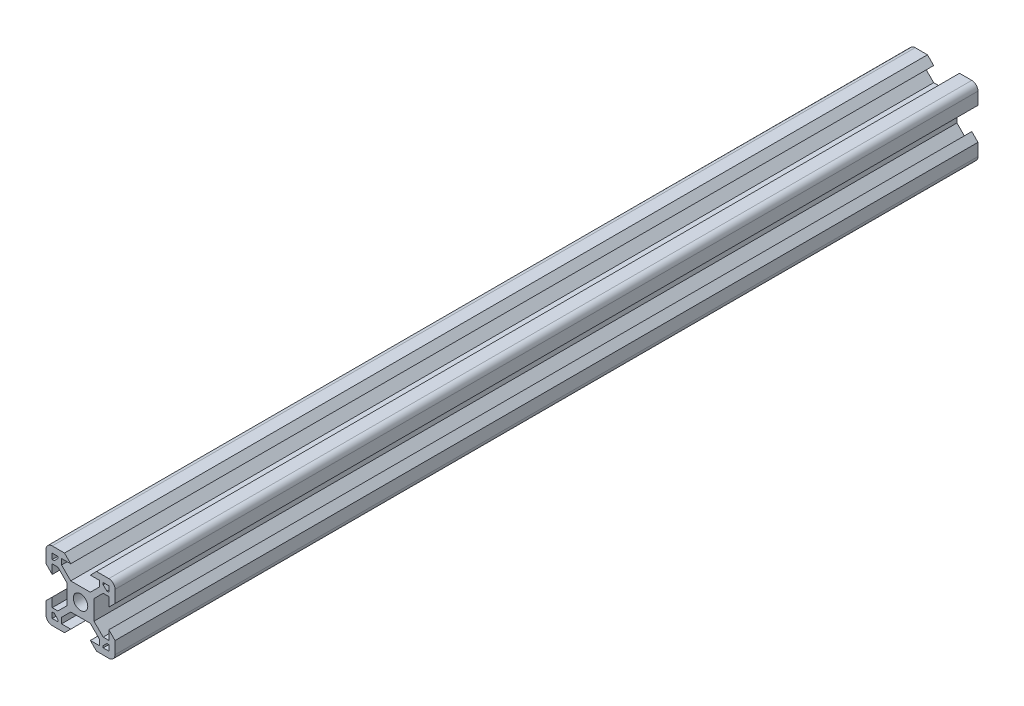
from build123d import *

# Parameters (mm, degrees)
ESQUISSE1_R        = 2.1
BOSS_EXTRU_2_DEPTH = 125


with BuildPart() as part:
    # Esquisse1 → Boss.-Extru.2 (new, symmetric)
    with BuildSketch(Plane.XY):
        with BuildLine():
            Line((-3.900660172, 0), (-3.900660172, -2.84))
            Line((-3.900660172, -2.84), (-6.56, -5.499339828))
            Line((-6.56, -5.499339828), (-8.2, -5.499339828))
            Line((-8.2, -5.499339828), (-8.2, -2.84))
            Line((-8.2, -2.84), (-10, -4.64))
            Line((-10, -4.64), (-10, -8.2))
            ThreePointArc((-10, -8.2), (-9.472792206, -9.472792206), (-8.2, -10))
            Line((-8.2, -10), (-4.64, -10))
            Line((-4.64, -10), (-2.84, -8.2))
            Line((-2.84, -8.2), (-5.499339828, -8.2))
            Line((-5.499339828, -8.2), (-5.499339828, -6.56))
            Line((-5.499339828, -6.56), (-2.84, -3.900660172))
            Line((-2.84, -3.900660172), (0, -3.900660172))
            Line((0, -3.900660172), (2.84, -3.900660172))
            Line((2.84, -3.900660172), (5.499339828, -6.56))
            Line((5.499339828, -6.56), (5.499339828, -8.2))
            Line((5.499339828, -8.2), (2.84, -8.2))
            Line((2.84, -8.2), (4.64, -10))
            Line((4.64, -10), (8.2, -10))
            ThreePointArc((8.2, -10), (9.472792206, -9.472792206), (10, -8.2))
            Line((10, -8.2), (10, -4.64))
            Line((10, -4.64), (8.2, -2.84))
            Line((8.2, -2.84), (8.2, -5.499339828))
            Line((8.2, -5.499339828), (6.56, -5.499339828))
            Line((6.56, -5.499339828), (3.900660172, -2.84))
            Line((3.900660172, -2.84), (3.900660172, 0))
            Line((3.900660172, 0), (3.900660172, 2.84))
            Line((3.900660172, 2.84), (6.56, 5.499339828))
            Line((6.56, 5.499339828), (8.2, 5.499339828))
            Line((8.2, 5.499339828), (8.2, 2.84))
            Line((8.2, 2.84), (10, 4.64))
            Line((10, 4.64), (10, 8.2))
            ThreePointArc((10, 8.2), (9.472792206, 9.472792206), (8.2, 10))
            Line((8.2, 10), (4.64, 10))
            Line((4.64, 10), (2.84, 8.2))
            Line((2.84, 8.2), (5.499339828, 8.2))
            Line((5.499339828, 8.2), (5.499339828, 6.56))
            Line((5.499339828, 6.56), (2.84, 3.900660172))
            Line((2.84, 3.900660172), (0, 3.900660172))
            Line((0, 3.900660172), (-2.84, 3.900660172))
            Line((-2.84, 3.900660172), (-5.499339828, 6.56))
            Line((-5.499339828, 6.56), (-5.499339828, 8.2))
            Line((-5.499339828, 8.2), (-2.84, 8.2))
            Line((-2.84, 8.2), (-4.64, 10))
            Line((-4.64, 10), (-8.2, 10))
            ThreePointArc((-8.2, 10), (-9.472792206, 9.472792206), (-10, 8.2))
            Line((-10, 8.2), (-10, 4.64))
            Line((-10, 4.64), (-8.2, 2.84))
            Line((-8.2, 2.84), (-8.2, 5.499339828))
            Line((-8.2, 5.499339828), (-6.56, 5.499339828))
            Line((-6.56, 5.499339828), (-3.900660172, 2.84))
            Line((-3.900660172, 2.84), (-3.900660172, 0))
        make_face()
        Circle(ESQUISSE1_R, mode=Mode.SUBTRACT)
        Polygon((-8.2, -8.2), (-8.2, -6.569339828), (-7.63, -6.569339828), (-6.569339828, -7.63), (-6.569339828, -8.2), align=None, mode=Mode.SUBTRACT)
        Polygon((-8.2, 6.569339828), (-8.2, 8.2), (-6.569339828, 8.2), (-6.569339828, 7.63), (-7.63, 6.569339828), align=None, mode=Mode.SUBTRACT)
        Polygon((6.569339828, 8.2), (8.2, 8.2), (8.2, 6.569339828), (7.63, 6.569339828), (6.569339828, 7.63), align=None, mode=Mode.SUBTRACT)
        Polygon((8.2, -6.569339828), (8.2, -8.2), (6.569339828, -8.2), (6.569339828, -7.63), (7.63, -6.569339828), align=None, mode=Mode.SUBTRACT)
    extrude(amount=BOSS_EXTRU_2_DEPTH, both=True)


solid = part.part
